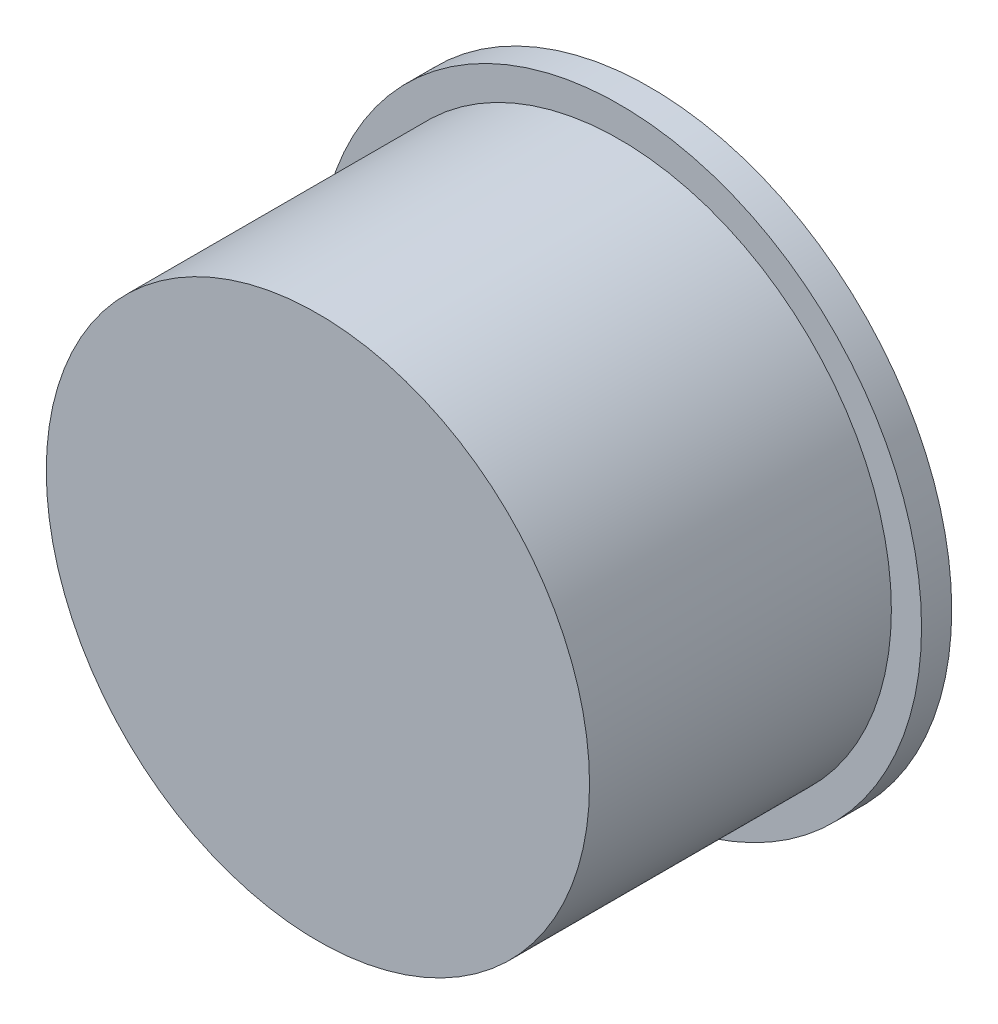
from build123d import *

# Parameters (mm, degrees)
SKETCH1_R           = 17.78
BOSS_EXTRUDE1_DEPTH = 5.08
SKETCH2_R           = 50.8
BOSS_EXTRUDE2_DEPTH = 5.08
SKETCH3_R           = 45.72
BOSS_EXTRUDE3_DEPTH = 50.8


with BuildPart() as part:
    # Sketch1 → Boss-Extrude1 (new body)
    with BuildSketch(Plane.XY):
        Circle(SKETCH1_R)
    extrude(amount=BOSS_EXTRUDE1_DEPTH)

    # Sketch2 → Boss-Extrude2 (add)
    with BuildSketch(Plane.XY.offset(5.08)):
        Circle(SKETCH2_R)
    extrude(amount=BOSS_EXTRUDE2_DEPTH)

    # Sketch3 → Boss-Extrude3 (add)
    with BuildSketch(Plane.XY.offset(10.16)):
        Circle(SKETCH3_R)
    extrude(amount=BOSS_EXTRUDE3_DEPTH)


solid = part.part
